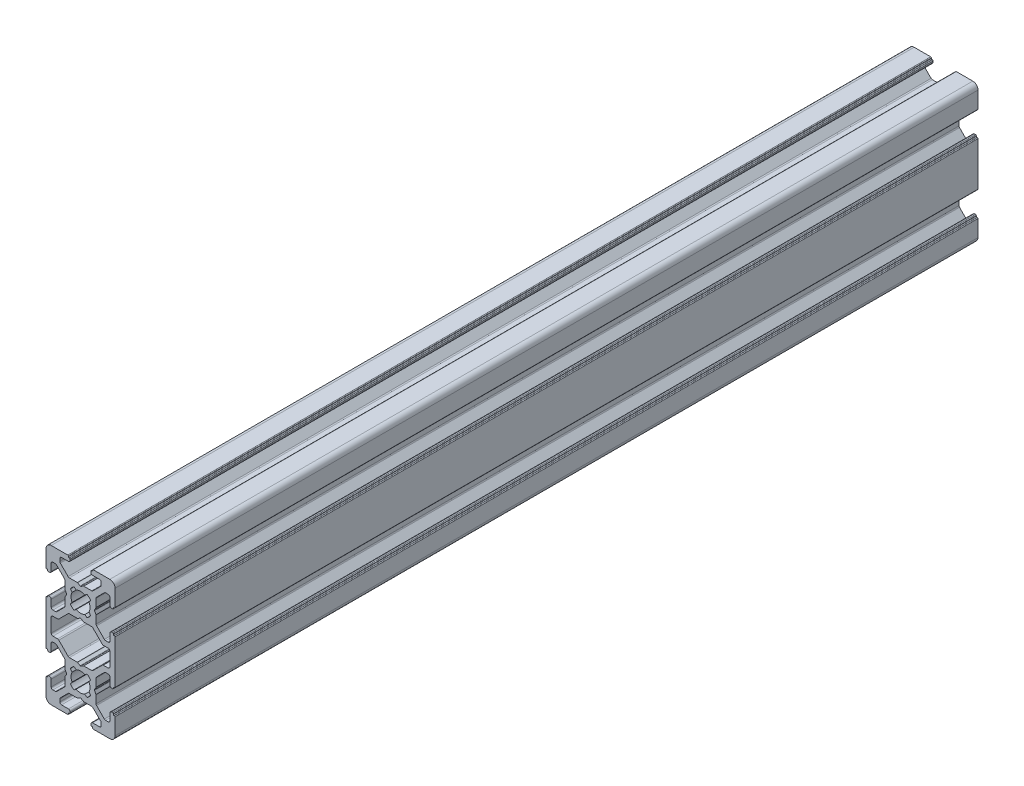
from build123d import *

# Parameters (mm, degrees)
EXTRUDE1_DEPTH = 250


with BuildPart() as part:
    # Sketch1 → Extrude1 (new body)
    with BuildSketch(Plane.XY):
        with BuildLine():
            Line((10, -3.749999824), (10, -8.500000461))
            ThreePointArc((10, -8.500000461), (9.560660307, -9.560660307), (8.500000461, -10))
            Line((8.500000461, -10), (3.699999971, -10))
            ThreePointArc((3.699999971, -10), (3.558578595, -9.941421336), (3.499999971, -9.799999942))
            Line((3.499999971, -9.799999942), (3.5, -9.699999942))
            ThreePointArc((3.5, -9.699999942), (3.441421377, -9.558578549), (3.3, -9.499999885))
            Line((3.3, -9.499999885), (3.2, -9.499999885))
            ThreePointArc((3.2, -9.499999885), (3.058578644, -9.441421241), (3, -9.299999885))
            Line((3, -9.299999885), (3, -9.000001846))
            ThreePointArc((3, -9.000001846), (3.146446609, -8.646448455), (3.5, -8.500001846))
            Line((3.5, -8.500001846), (5.499999866, -8.500001846))
            ThreePointArc((5.499999866, -8.500001846), (5.853553351, -8.353555197), (6, -8.000001712))
            Line((6, -8.000001712), (6, -7.267766328))
            ThreePointArc((6, -7.267766328), (5.961939756, -7.076424587), (5.853553353, -6.914212899))
            Line((5.853553353, -6.914212899), (3.585786596, -4.646446628))
            ThreePointArc((3.585786596, -4.646446628), (3.423574935, -4.53806028), (3.232233243, -4.500000057))
            Line((3.232233243, -4.500000057), (0.953593447, -4.500000057))
            ThreePointArc((0.953593447, -4.500000057), (0.901829637, -4.493185222), (0.853593445, -4.473205136))
            Line((0.853593445, -4.473205136), (0.100000013, -4.038117753))
            ThreePointArc((0.100000013, -4.038117753), (0, -4.011322829), (-0.100000013, -4.038117753))
            Line((-0.100000013, -4.038117753), (-0.853593445, -4.473205136))
            ThreePointArc((-0.853593445, -4.473205136), (-0.901829637, -4.493185222), (-0.953593447, -4.500000057))
            Line((-0.953593447, -4.500000057), (-3.232233243, -4.500000057))
            ThreePointArc((-3.232233243, -4.500000057), (-3.423574935, -4.53806028), (-3.585786596, -4.646446628))
            Line((-3.585786596, -4.646446628), (-5.853553353, -6.914212899))
            ThreePointArc((-5.853553353, -6.914212899), (-5.961939756, -7.076424587), (-6, -7.267766328))
            Line((-6, -7.267766328), (-6, -8.000000007))
            ThreePointArc((-6, -8.000000007), (-5.85355339, -8.353553398), (-5.499999998, -8.500000007))
            Line((-5.499999998, -8.500000007), (-3.500000002, -8.5))
            ThreePointArc((-3.500000002, -8.5), (-3.14644661, -8.646446609), (-3, -9))
            Line((-3, -9), (-3, -9.299998039))
            ThreePointArc((-3, -9.299998039), (-3.058578644, -9.441419395), (-3.2, -9.499998039))
            Line((-3.2, -9.499998039), (-3.3, -9.499998039))
            ThreePointArc((-3.3, -9.499998039), (-3.441421703, -9.558577029), (-3.5, -9.699999019))
            Line((-3.5, -9.699999019), (-3.49999951, -9.799999019))
            ThreePointArc((-3.49999951, -9.799999019), (-3.558577807, -9.94142101), (-3.69999951, -10))
            Line((-3.69999951, -10), (-8.5, -10))
            ThreePointArc((-8.5, -10), (-9.560660172, -9.560660172), (-10, -8.5))
            Line((-10, -8.5), (-10, -3.749999824))
            ThreePointArc((-10, -3.749999824), (-9.941421232, -3.608578344), (-9.799999649, -3.549999824))
            Line((-9.799999649, -3.549999824), (-9.699999649, -3.55))
            ThreePointArc((-9.699999649, -3.55), (-9.558578066, -3.49142148), (-9.499999298, -3.35))
            Line((-9.499999298, -3.35), (-9.499999298, -3.25))
            ThreePointArc((-9.499999298, -3.25), (-9.441420654, -3.108578644), (-9.299999298, -3.05))
            Line((-9.299999298, -3.05), (-8.999999788, -3.05))
            ThreePointArc((-8.999999788, -3.05), (-8.646446398, -3.196446609), (-8.499999788, -3.55))
            Line((-8.499999788, -3.55), (-8.499999788, -5.50000039))
            ThreePointArc((-8.499999788, -5.50000039), (-8.35355314, -5.853553875), (-7.999999654, -6.000000524))
            Line((-7.999999654, -6.000000524), (-7.267766643, -6.000000524))
            ThreePointArc((-7.267766643, -6.000000524), (-7.076424734, -5.96194021), (-6.914212957, -5.853553619))
            Line((-6.914212957, -5.853553619), (-4.646446283, -3.585783155))
            ThreePointArc((-4.646446283, -3.585783155), (-4.538060123, -3.423571583), (-4.499999969, -3.23223006))
            Line((-4.499999969, -3.23223006), (-4.499999969, -0.953590264))
            ThreePointArc((-4.499999969, -0.953590264), (-4.493185135, -0.901826456), (-4.473205051, -0.853590266))
            Line((-4.473205051, -0.853590266), (-4.038119483, -0.099999935))
            ThreePointArc((-4.038119483, -0.099999935), (-4.011324562, 7.7e-08), (-4.038119486, 0.100000089))
            Line((-4.038119486, 0.100000089), (-4.473205047, 0.853590344))
            ThreePointArc((-4.473205047, 0.853590344), (-4.493185134, 0.901826537), (-4.499999969, 0.953590348))
            Line((-4.499999969, 0.953590348), (-4.499999969, 3.232230144))
            ThreePointArc((-4.499999969, 3.232230144), (-4.538060128, 3.423571679), (-4.6464463, 3.585783257))
            Line((-4.6464463, 3.585783257), (-6.914212063, 5.853552589))
            ThreePointArc((-6.914212063, 5.853552589), (-7.076423834, 5.961939167), (-7.267765732, 5.999999476))
            Line((-7.267765732, 5.999999476), (-8.000000569, 5.999999476))
            ThreePointArc((-8.000000569, 5.999999476), (-8.35355396, 5.853552867), (-8.500000569, 5.499999476))
            Line((-8.500000569, 5.499999476), (-8.500000569, 3.45))
            ThreePointArc((-8.500000569, 3.45), (-8.646447179, 3.096446609), (-9.000000569, 2.95))
            Line((-9.000000569, 2.95), (-9.300000079, 2.95))
            ThreePointArc((-9.300000079, 2.95), (-9.441421491, 3.008578699), (-9.500000079, 3.150000158))
            Line((-9.500000079, 3.150000158), (-9.5, 3.250000158))
            ThreePointArc((-9.5, 3.250000158), (-9.558578588, 3.391421616), (-9.7, 3.450000315))
            Line((-9.7, 3.450000315), (-9.8, 3.450000315))
            ThreePointArc((-9.8, 3.450000315), (-9.941421356, 3.508578959), (-10, 3.650000315))
            Line((-10, 3.650000315), (-10, 9.999999757))
            Line((-10, 9.999999757), (-10, 16.3))
            ThreePointArc((-10, 16.3), (-9.941421356, 16.441421356), (-9.8, 16.5))
            Line((-9.8, 16.5), (-9.7, 16.5))
            ThreePointArc((-9.7, 16.5), (-9.558578644, 16.558578644), (-9.5, 16.7))
            Line((-9.5, 16.7), (-9.5, 16.8))
            ThreePointArc((-9.5, 16.8), (-9.441421356, 16.941421356), (-9.3, 17))
            Line((-9.3, 17), (-9.00000049, 17))
            ThreePointArc((-9.00000049, 17), (-8.6464471, 16.853553391), (-8.50000049, 16.5))
            Line((-8.50000049, 16.5), (-8.50000049, 14.55))
            ThreePointArc((-8.50000049, 14.55), (-8.353553881, 14.196446609), (-8.00000049, 14.05))
            Line((-8.00000049, 14.05), (-7.217766334, 14.05))
            ThreePointArc((-7.217766334, 14.05), (-7.026424436, 14.088060309), (-6.864212665, 14.196446888))
            Line((-6.864212665, 14.196446888), (-4.6464463, 16.414216743))
            ThreePointArc((-4.6464463, 16.414216743), (-4.538060128, 16.576428321), (-4.499999969, 16.767769856))
            Line((-4.499999969, 16.767769856), (-4.499999969, 19.046409652))
            ThreePointArc((-4.499999969, 19.046409652), (-4.493185134, 19.098173463), (-4.473205047, 19.146409656))
            Line((-4.473205047, 19.146409656), (-4.038119486, 19.899999911))
            ThreePointArc((-4.038119486, 19.899999911), (-4.011324562, 19.999999923), (-4.038119483, 20.099999935))
            Line((-4.038119483, 20.099999935), (-4.473205051, 20.853590266))
            ThreePointArc((-4.473205051, 20.853590266), (-4.493185135, 20.901826456), (-4.499999969, 20.953590264))
            Line((-4.499999969, 20.953590264), (-4.499999969, 23.23223006))
            ThreePointArc((-4.499999969, 23.23223006), (-4.538060123, 23.423571583), (-4.646446283, 23.585783155))
            Line((-4.646446283, 23.585783155), (-6.96421235, 25.903553095))
            ThreePointArc((-6.96421235, 25.903553095), (-7.126424126, 26.011939686), (-7.317766036, 26.05))
            Line((-7.317766036, 26.05), (-7.999999654, 26.05))
            ThreePointArc((-7.999999654, 26.05), (-8.35355314, 25.903553351), (-8.499999788, 25.549999866))
            Line((-8.499999788, 25.549999866), (-8.499999788, 23.5))
            ThreePointArc((-8.499999788, 23.5), (-8.646446398, 23.146446609), (-8.999999788, 23))
            Line((-8.999999788, 23), (-9.299999298, 23))
            ThreePointArc((-9.299999298, 23), (-9.441420654, 23.058578644), (-9.499999298, 23.2))
            Line((-9.499999298, 23.2), (-9.499999298, 23.3))
            ThreePointArc((-9.499999298, 23.3), (-9.558578066, 23.44142148), (-9.699999649, 23.5))
            Line((-9.699999649, 23.5), (-9.799999649, 23.499999824))
            ThreePointArc((-9.799999649, 23.499999824), (-9.941421232, 23.558578344), (-10, 23.699999824))
            Line((-10, 23.699999824), (-10, 28.5))
            ThreePointArc((-10, 28.5), (-9.560660172, 29.560660172), (-8.5, 30))
            Line((-8.5, 30), (-3.699999511, 30))
            ThreePointArc((-3.699999511, 30), (-3.55857781, 29.941421011), (-3.499999511, 29.799999023))
            Line((-3.499999511, 29.799999023), (-3.5, 29.699999023))
            ThreePointArc((-3.5, 29.699999023), (-3.441421702, 29.558577035), (-3.3, 29.499998046))
            Line((-3.3, 29.499998046), (-3.2, 29.499998046))
            ThreePointArc((-3.2, 29.499998046), (-3.058578644, 29.441419402), (-3, 29.299998046))
            Line((-3, 29.299998046), (-3, 29.000000007))
            ThreePointArc((-3, 29.000000007), (-3.146446609, 28.646446616), (-3.5, 28.500000007))
            Line((-3.5, 28.500000007), (-5.5, 28.500000007))
            ThreePointArc((-5.5, 28.500000007), (-5.853553391, 28.353553397), (-6, 28.000000007))
            Line((-6, 28.000000007), (-6, 27.267766328))
            ThreePointArc((-6, 27.267766328), (-5.961940442, 27.076426242), (-5.853555886, 26.914215433))
            Line((-5.853555886, 26.914215433), (-3.585869751, 24.646497282))
            ThreePointArc((-3.585869751, 24.646497282), (-3.423657211, 24.538109086), (-3.232313865, 24.500048177))
            Line((-3.232313865, 24.500048177), (-0.953674069, 24.500048177))
            ThreePointArc((-0.953674069, 24.500048177), (-0.901910257, 24.493233342), (-0.853674064, 24.473253255))
            Line((-0.853674064, 24.473253255), (-0.100000047, 24.038119334))
            ThreePointArc((-0.100000047, 24.038119334), (-3.5e-08, 24.011324409), (0.099999978, 24.03811933))
            Line((0.099999978, 24.03811933), (0.853674071, 24.473253259))
            ThreePointArc((0.853674071, 24.473253259), (0.901910261, 24.493233342), (0.953674069, 24.500048177))
            Line((0.953674069, 24.500048177), (3.232313865, 24.500048177))
            ThreePointArc((3.232313865, 24.500048177), (3.423657211, 24.538109086), (3.585869751, 24.646497282))
            Line((3.585869751, 24.646497282), (5.853555886, 26.914215433))
            ThreePointArc((5.853555886, 26.914215433), (5.961940442, 27.076426242), (6, 27.267766328))
            Line((6, 27.267766328), (6, 28.000001712))
            ThreePointArc((6, 28.000001712), (5.853553351, 28.353555197), (5.499999866, 28.500001846))
            Line((5.499999866, 28.500001846), (3.5, 28.500001846))
            ThreePointArc((3.5, 28.500001846), (3.146446609, 28.646448455), (3, 29.000001846))
            Line((3, 29.000001846), (3, 29.299999885))
            ThreePointArc((3, 29.299999885), (3.058578562, 29.441421159), (3.199999769, 29.499999885))
            Line((3.199999769, 29.499999885), (3.299999769, 29.5))
            ThreePointArc((3.299999769, 29.5), (3.441420976, 29.558578725), (3.499999539, 29.7))
            Line((3.499999539, 29.7), (3.499999539, 29.8))
            ThreePointArc((3.499999539, 29.8), (3.558578182, 29.941421356), (3.699999539, 30))
            Line((3.699999539, 30), (8.500000027, 30))
            ThreePointArc((8.500000027, 30), (9.56066018, 29.56066018), (10, 28.500000027))
            Line((10, 28.500000027), (10, 23.699999824))
            ThreePointArc((10, 23.699999824), (9.941421232, 23.558578344), (9.799999649, 23.499999824))
            Line((9.799999649, 23.499999824), (9.699999649, 23.5))
            ThreePointArc((9.699999649, 23.5), (9.558578066, 23.44142148), (9.499999298, 23.3))
            Line((9.499999298, 23.3), (9.499999298, 23.2))
            ThreePointArc((9.499999298, 23.2), (9.441420654, 23.058578644), (9.299999298, 23))
            Line((9.299999298, 23), (8.999999788, 23))
            ThreePointArc((8.999999788, 23), (8.646446398, 23.146446609), (8.499999788, 23.5))
            Line((8.499999788, 23.5), (8.499999788, 25.499999261))
            ThreePointArc((8.499999788, 25.499999261), (8.353553179, 25.853552652), (7.999999788, 25.999999261))
            Line((7.999999788, 25.999999261), (7.267765381, 25.999999261))
            ThreePointArc((7.267765381, 25.999999261), (7.076423471, 25.961938948), (6.914211695, 25.853552357))
            Line((6.914211695, 25.853552357), (4.646446283, 23.585783155))
            ThreePointArc((4.646446283, 23.585783155), (4.538060123, 23.423571583), (4.499999969, 23.23223006))
            Line((4.499999969, 23.23223006), (4.499999969, 20.953590264))
            ThreePointArc((4.499999969, 20.953590264), (4.493185135, 20.901826456), (4.473205051, 20.853590266))
            Line((4.473205051, 20.853590266), (4.038119525, 20.100000009))
            ThreePointArc((4.038119525, 20.100000009), (4.011324604, 20.000000005), (4.03811952, 19.899999999))
            Line((4.03811952, 19.899999999), (4.473205056, 19.146409641))
            ThreePointArc((4.473205056, 19.146409641), (4.493185136, 19.098173455), (4.499999969, 19.046409652))
            Line((4.499999969, 19.046409652), (4.499999969, 16.767769856))
            ThreePointArc((4.499999969, 16.767769856), (4.538060128, 16.576428321), (4.6464463, 16.414216743))
            Line((4.6464463, 16.414216743), (6.914213325, 14.146446149))
            ThreePointArc((6.914213325, 14.146446149), (7.076425096, 14.03805957), (7.267766994, 13.999999261))
            Line((7.267766994, 13.999999261), (7.999999654, 13.999999261))
            ThreePointArc((7.999999654, 13.999999261), (8.35355314, 14.14644591), (8.499999788, 14.499999395))
            Line((8.499999788, 14.499999395), (8.499999788, 16.5))
            ThreePointArc((8.499999788, 16.5), (8.646446398, 16.853553391), (8.999999788, 17))
            Line((8.999999788, 17), (9.299999298, 17))
            ThreePointArc((9.299999298, 17), (9.441420654, 16.941421356), (9.499999298, 16.8))
            Line((9.499999298, 16.8), (9.499999298, 16.7))
            ThreePointArc((9.499999298, 16.7), (9.558578066, 16.55857852), (9.699999649, 16.5))
            Line((9.699999649, 16.5), (9.799999649, 16.500000176))
            ThreePointArc((9.799999649, 16.500000176), (9.941421232, 16.441421656), (10, 16.300000176))
            Line((10, 16.300000176), (10, 10))
            Line((10, 10), (10, 3.650000315))
            ThreePointArc((10, 3.650000315), (9.941421356, 3.508578959), (9.8, 3.450000315))
            Line((9.8, 3.450000315), (9.7, 3.450000315))
            ThreePointArc((9.7, 3.450000315), (9.558578588, 3.391421616), (9.5, 3.250000158))
            Line((9.5, 3.250000158), (9.500000079, 3.150000158))
            ThreePointArc((9.500000079, 3.150000158), (9.441421491, 3.0085787), (9.300000079, 2.95))
            Line((9.300000079, 2.95), (9.000000569, 2.95))
            ThreePointArc((9.000000569, 2.95), (8.646447179, 3.096446609), (8.500000569, 3.45))
            Line((8.500000569, 3.45), (8.500000569, 5.499999342))
            ThreePointArc((8.500000569, 5.499999342), (8.353553921, 5.853552828), (8.000000435, 5.999999476))
            Line((8.000000435, 5.999999476), (7.267765732, 5.999999476))
            ThreePointArc((7.267765732, 5.999999476), (7.076423834, 5.961939167), (6.914212063, 5.853552589))
            Line((6.914212063, 5.853552589), (4.6464463, 3.585783257))
            ThreePointArc((4.6464463, 3.585783257), (4.538060128, 3.423571679), (4.499999969, 3.232230144))
            Line((4.499999969, 3.232230144), (4.499999969, 0.953590348))
            ThreePointArc((4.499999969, 0.953590348), (4.493185136, 0.901826545), (4.473205056, 0.853590359))
            Line((4.473205056, 0.853590359), (4.03811952, 0.100000001))
            ThreePointArc((4.03811952, 0.100000001), (4.011324604, -5e-09), (4.038119525, -0.100000009))
            Line((4.038119525, -0.100000009), (4.473205051, -0.853590266))
            ThreePointArc((4.473205051, -0.853590266), (4.493185135, -0.901826456), (4.499999969, -0.953590264))
            Line((4.499999969, -0.953590264), (4.499999969, -3.23223006))
            ThreePointArc((4.499999969, -3.23223006), (4.538060123, -3.423571583), (4.646446283, -3.585783155))
            Line((4.646446283, -3.585783155), (6.914212957, -5.853553619))
            ThreePointArc((6.914212957, -5.853553619), (7.076424734, -5.96194021), (7.267766643, -6.000000524))
            Line((7.267766643, -6.000000524), (7.999999788, -6.000000524))
            ThreePointArc((7.999999788, -6.000000524), (8.353553179, -5.853553914), (8.499999788, -5.500000524))
            Line((8.499999788, -5.500000524), (8.499999788, -3.55))
            ThreePointArc((8.499999788, -3.55), (8.646446398, -3.196446609), (8.999999788, -3.05))
            Line((8.999999788, -3.05), (9.299999298, -3.05))
            ThreePointArc((9.299999298, -3.05), (9.441420654, -3.108578644), (9.499999298, -3.25))
            Line((9.499999298, -3.25), (9.499999298, -3.35))
            ThreePointArc((9.499999298, -3.35), (9.558578066, -3.49142148), (9.699999649, -3.55))
            Line((9.699999649, -3.55), (9.799999649, -3.549999824))
            ThreePointArc((9.799999649, -3.549999824), (9.941421232, -3.608578344), (10, -3.749999824))
        make_face()
        with BuildLine():
            Line((2.445295362, 18.741814564), (2.947714945, 18.112944992))
            ThreePointArc((2.947714945, 18.112944992), (2.474873674, 17.525126206), (1.887054865, 17.052284963))
            Line((1.887054865, 17.052284963), (1.258185317, 17.554704577))
            ThreePointArc((1.258185317, 17.554704577), (-6.7e-08, 17.25), (-1.258185436, 17.554704638))
            Line((-1.258185436, 17.554704638), (-1.887055008, 17.052285055))
            ThreePointArc((-1.887055008, 17.052285055), (-2.474873794, 17.525126326), (-2.947715037, 18.112945135))
            Line((-2.947715037, 18.112945135), (-2.445295423, 18.741814683))
            ThreePointArc((-2.445295423, 18.741814683), (-2.75, 20.000000067), (-2.445295362, 21.258185436))
            Line((-2.445295362, 21.258185436), (-2.947714945, 21.887055008))
            ThreePointArc((-2.947714945, 21.887055008), (-2.474873674, 22.474873794), (-1.887054865, 22.947715037))
            Line((-1.887054865, 22.947715037), (-1.258185317, 22.445295423))
            ThreePointArc((-1.258185317, 22.445295423), (6.7e-08, 22.75), (1.258185436, 22.445295362))
            Line((1.258185436, 22.445295362), (1.887055008, 22.947714945))
            ThreePointArc((1.887055008, 22.947714945), (2.474873794, 22.474873674), (2.947715037, 21.887054865))
            Line((2.947715037, 21.887054865), (2.445295423, 21.258185317))
            ThreePointArc((2.445295423, 21.258185317), (2.75, 19.999999933), (2.445295362, 18.741814564))
        make_face(mode=Mode.SUBTRACT)
        with BuildLine():
            Line((3.232248767, 15.499989219), (0.953608971, 15.499989219))
            ThreePointArc((0.953608971, 15.499989219), (0.90184516, 15.506804055), (0.853608967, 15.526784141))
            Line((0.853608967, 15.526784141), (0.100000047, 15.961880478))
            ThreePointArc((0.100000047, 15.961880478), (3.5e-08, 15.988675403), (-0.099999978, 15.961880482))
            Line((-0.099999978, 15.961880482), (-0.853608973, 15.526784137))
            ThreePointArc((-0.853608973, 15.526784137), (-0.901845163, 15.506804054), (-0.953608971, 15.499989219))
            Line((-0.953608971, 15.499989219), (-3.232248767, 15.499989219))
            ThreePointArc((-3.232248767, 15.499989219), (-3.42359066, 15.461928912), (-3.585802428, 15.35354234))
            Line((-3.585802428, 15.35354234), (-6.292893753, 12.646446879))
            ThreePointArc((-6.292893753, 12.646446879), (-6.455105521, 12.538060307), (-6.646447414, 12.5))
            Line((-6.646447414, 12.5), (-7.999999788, 12.5))
            ThreePointArc((-7.999999788, 12.5), (-8.353553179, 12.353553391), (-8.499999788, 12))
            Line((-8.499999788, 12), (-8.499999788, 8))
            ThreePointArc((-8.499999788, 8), (-8.353553179, 7.646446609), (-7.999999788, 7.5))
            Line((-7.999999788, 7.5), (-6.646447414, 7.5))
            ThreePointArc((-6.646447414, 7.5), (-6.455102332, 7.461938372), (-6.292888871, 7.353548238))
            Line((-6.292888871, 7.353548238), (-3.585984195, 4.646564667))
            ThreePointArc((-3.585984195, 4.646564667), (-3.423770734, 4.538174533), (-3.232425652, 4.500112905))
            Line((-3.232425652, 4.500112905), (-0.953785856, 4.500112905))
            ThreePointArc((-0.953785856, 4.500112905), (-0.902022048, 4.493298071), (-0.853785858, 4.473317987))
            Line((-0.853785858, 4.473317987), (-0.099999978, 4.038119518))
            ThreePointArc((-0.099999978, 4.038119518), (3.5e-08, 4.011324597), (0.100000047, 4.038119522))
            Line((0.100000047, 4.038119522), (0.853785852, 4.473317984))
            ThreePointArc((0.853785852, 4.473317984), (0.902022045, 4.49329807), (0.953785856, 4.500112905))
            Line((0.953785856, 4.500112905), (3.232425652, 4.500112905))
            ThreePointArc((3.232425652, 4.500112905), (3.423770734, 4.538174533), (3.585984195, 4.646564667))
            Line((3.585984195, 4.646564667), (6.292888591, 7.353547959))
            ThreePointArc((6.292888591, 7.353547959), (6.455102052, 7.461938093), (6.646447134, 7.49999972))
            Line((6.646447134, 7.49999972), (7.999999788, 7.49999972))
            ThreePointArc((7.999999788, 7.49999972), (8.353553179, 7.64644633), (8.499999788, 7.99999972))
            Line((8.499999788, 7.99999972), (8.499999788, 12.000000281))
            ThreePointArc((8.499999788, 12.000000281), (8.353553179, 12.353553672), (7.999999788, 12.500000281))
            Line((7.999999788, 12.500000281), (6.646447132, 12.500000281))
            ThreePointArc((6.646447132, 12.500000281), (6.45510524, 12.538060588), (6.292893472, 12.646447161))
            Line((6.292893472, 12.646447161), (3.585802428, 15.35354234))
            ThreePointArc((3.585802428, 15.35354234), (3.42359066, 15.461928912), (3.232248767, 15.499989219))
        make_face(mode=Mode.SUBTRACT)
        with BuildLine():
            Line((1.258185436, -2.445295362), (1.887055008, -2.947714945))
            ThreePointArc((1.887055008, -2.947714945), (2.474873794, -2.474873674), (2.947715037, -1.887054865))
            Line((2.947715037, -1.887054865), (2.445295423, -1.258185317))
            ThreePointArc((2.445295423, -1.258185317), (2.75, 6.7e-08), (2.445295362, 1.258185436))
            Line((2.445295362, 1.258185436), (2.947714945, 1.887055008))
            ThreePointArc((2.947714945, 1.887055008), (2.474873674, 2.474873794), (1.887054865, 2.947715037))
            Line((1.887054865, 2.947715037), (1.258185317, 2.445295423))
            ThreePointArc((1.258185317, 2.445295423), (-6.7e-08, 2.75), (-1.258185436, 2.445295362))
            Line((-1.258185436, 2.445295362), (-1.887055008, 2.947714945))
            ThreePointArc((-1.887055008, 2.947714945), (-2.474873794, 2.474873674), (-2.947715037, 1.887054865))
            Line((-2.947715037, 1.887054865), (-2.445295423, 1.258185317))
            ThreePointArc((-2.445295423, 1.258185317), (-2.75, -6.7e-08), (-2.445295362, -1.258185436))
            Line((-2.445295362, -1.258185436), (-2.947714945, -1.887055008))
            ThreePointArc((-2.947714945, -1.887055008), (-2.474873674, -2.474873794), (-1.887054865, -2.947715037))
            Line((-1.887054865, -2.947715037), (-1.258185317, -2.445295423))
            ThreePointArc((-1.258185317, -2.445295423), (6.7e-08, -2.75), (1.258185436, -2.445295362))
        make_face(mode=Mode.SUBTRACT)
    extrude(amount=EXTRUDE1_DEPTH)


solid = part.part
